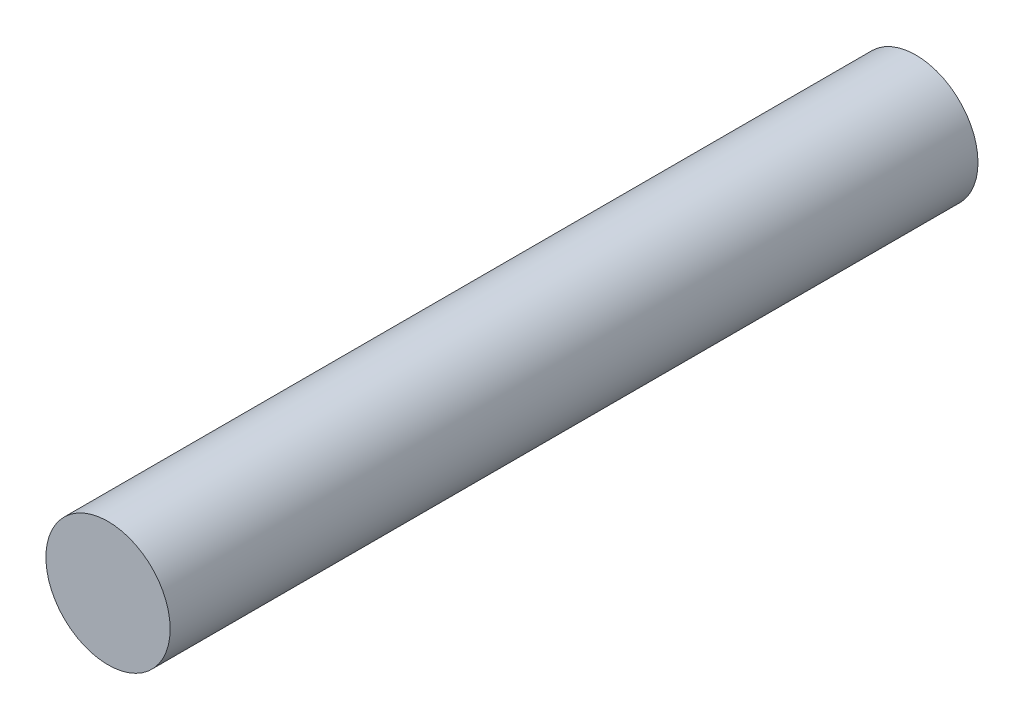
from build123d import *

# Parameters (mm, degrees)
SKETCH1_R           = 6.35
BOSS_EXTRUDE1_DEPTH = 82.55


with BuildPart() as part:
    # Sketch1 → Boss-Extrude1 (new body)
    with BuildSketch(Plane.XY):
        Circle(SKETCH1_R)
    extrude(amount=BOSS_EXTRUDE1_DEPTH)


solid = part.part
